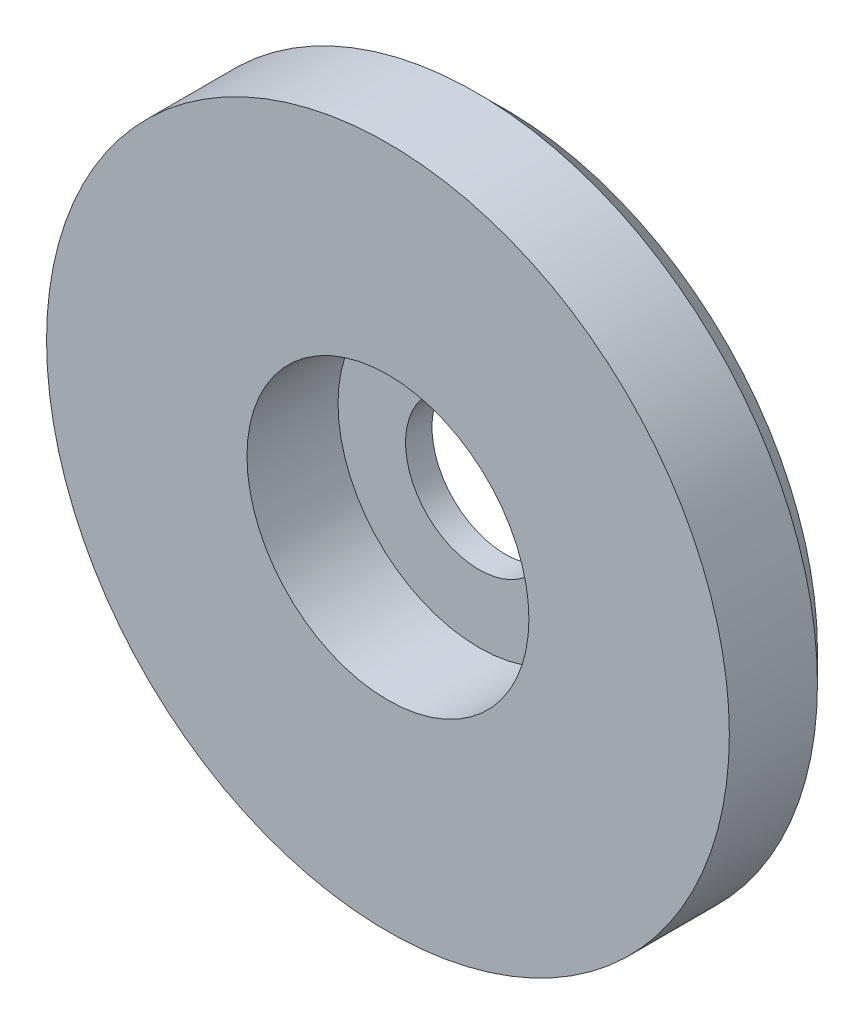
from build123d import *

# Parameters (mm, degrees)
SKETCH1_R           = 23.25
BOSS_EXTRUDE1_DEPTH = 8
SKETCH2_R           = 9.6
CUT_EXTRUDE1_DEPTH  = 6.2
SKETCH3_R           = 5
CUT_EXTRUDE2_DEPTH  = 1.8
CHAMFER1_SIZE       = 2


with BuildPart() as part:
    # Sketch1 → Boss-Extrude1 (new body)
    with BuildSketch(Plane.XY):
        Circle(SKETCH1_R)
    extrude(amount=BOSS_EXTRUDE1_DEPTH)

    # Sketch2 → Cut-Extrude1 (cut)
    with BuildSketch(Plane.XY.offset(8)):
        Circle(SKETCH2_R)
    extrude(amount=-CUT_EXTRUDE1_DEPTH, mode=Mode.SUBTRACT)

    # Sketch3 → Cut-Extrude2 (cut)
    with BuildSketch(Plane.XY.offset(1.8)):
        Circle(SKETCH3_R)
    extrude(amount=-CUT_EXTRUDE2_DEPTH, mode=Mode.SUBTRACT)

    # Chamfer1
    chamfer1_edges = [part.edges().sort_by_distance(p)[0] for p in [
        (-23.25, 0, 0),
    ]]
    chamfer(chamfer1_edges, length=CHAMFER1_SIZE)


solid = part.part
